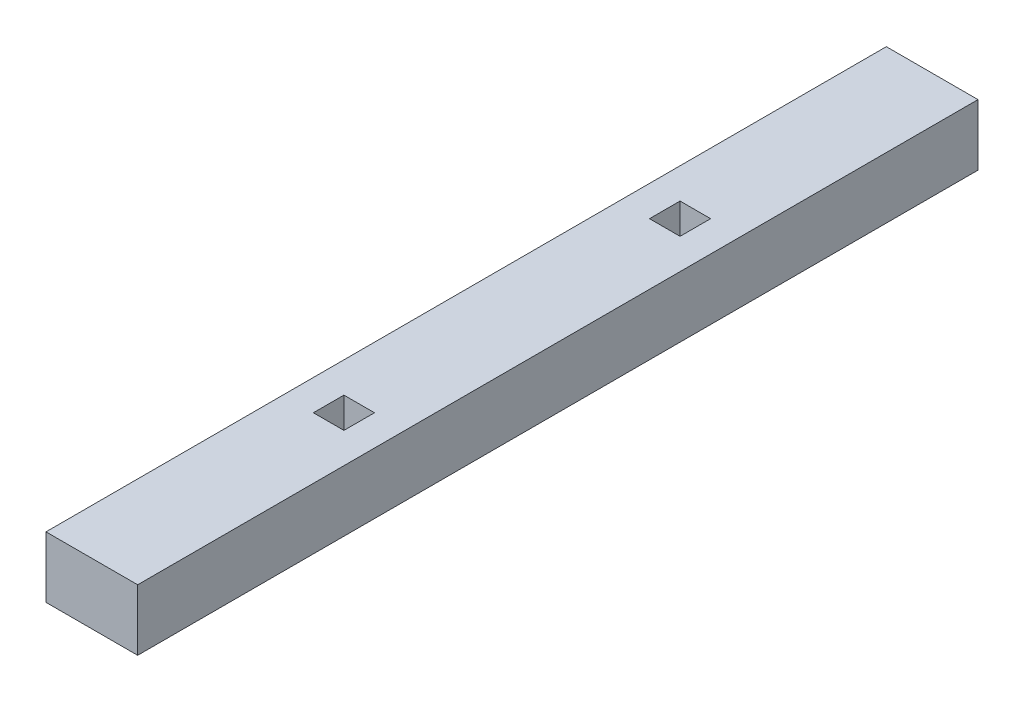
from build123d import *

# Parameters (mm, degrees)
SKETCH1_W           = 30
SKETCH1_H           = 275
SKETCH1_W_2         = 10
SKETCH1_H_2         = 10
BOSS_EXTRUDE1_DEPTH = 20


with BuildPart() as part:
    # Sketch1 → Boss-Extrude1 (new body)
    with BuildSketch(Plane(origin=(0, 0, 0), x_dir=(1, 0, 0), z_dir=(0, 1, 0))):
        with Locations((0, -5)):
            Rectangle(SKETCH1_W, SKETCH1_H)
        with Locations((0, 50)):
            Rectangle(SKETCH1_W_2, SKETCH1_H_2, mode=Mode.SUBTRACT)
        with Locations((0, -60)):
            Rectangle(SKETCH1_W_2, SKETCH1_H_2, mode=Mode.SUBTRACT)
    extrude(amount=BOSS_EXTRUDE1_DEPTH)


solid = part.part
